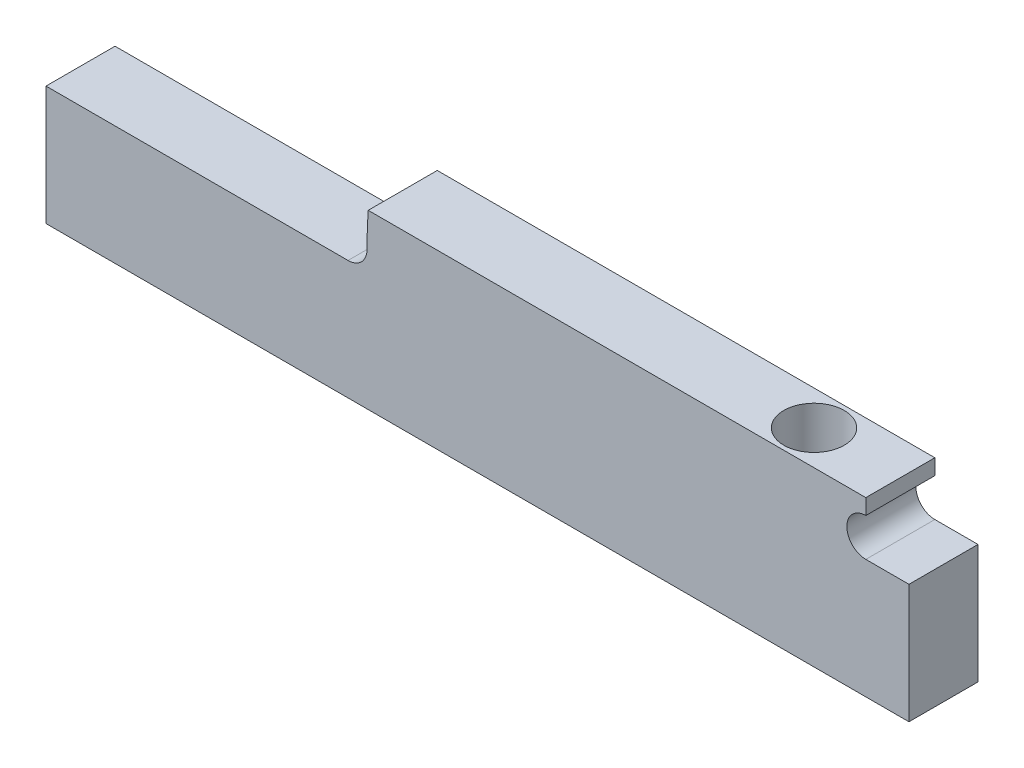
from build123d import *

# Parameters (mm, degrees)
BOSS_EXTRUDE2_DEPTH = 8
SKETCH2_R           = 2
CUT_EXTRUDE1_DEPTH  = 20
SKETCH3_R           = 3.5
CUT_EXTRUDE2_DEPTH  = 15


with BuildPart() as part:
    # Sketch1 → Boss-Extrude2 (new body)
    with BuildSketch(Plane.XY):
        with BuildLine():
            Line((-56.573708053, 24.587270805), (1.087717528, 24.587270805))
            Line((1.087717528, 24.587270805), (1.087717528, 22.787270805))
            ThreePointArc((1.087717528, 22.787270805), (-1.112282472, 20.587270805), (1.087717528, 18.387270805))
            Line((1.087717528, 18.387270805), (6.087717528, 18.387270805))
            Line((6.087717528, 18.387270805), (6.087717528, 4.587270805))
            Line((6.087717528, 4.587270805), (-93.912282472, 4.587270805))
            Line((-93.912282472, 4.587270805), (-93.912282472, 18.387270805))
            Line((-93.912282472, 18.387270805), (-58.912282472, 18.387270805))
            ThreePointArc((-58.912282472, 18.387270805), (-57.356647554, 19.031635886), (-56.712282472, 20.587270805))
            ThreePointArc((-56.712282472, 20.587270805), (-56.677628479, 22.588470624), (-56.573708053, 24.587270805))
        make_face()
    extrude(amount=BOSS_EXTRUDE2_DEPTH)

    # Sketch2 → Cut-Extrude1 (cut)
    with BuildSketch(Plane(origin=(0, 24.587270805, 0), x_dir=(1, 0, 0), z_dir=(0, 1, 0))):
        with Locations(Location((-8.912282472, -4, 0), (0, 0, 270))):
            Circle(SKETCH2_R)
    extrude(amount=-CUT_EXTRUDE1_DEPTH, mode=Mode.SUBTRACT)

    # Sketch3 → Cut-Extrude2 (cut)
    with BuildSketch(Plane(origin=(0, 24.587270805, 0), x_dir=(1, 0, 0), z_dir=(0, 1, 0))):
        with Locations(Location((-8.912282472, -4, 0), (0, 0, 270))):
            Circle(SKETCH3_R)
    extrude(amount=-CUT_EXTRUDE2_DEPTH, mode=Mode.SUBTRACT)


solid = part.part
